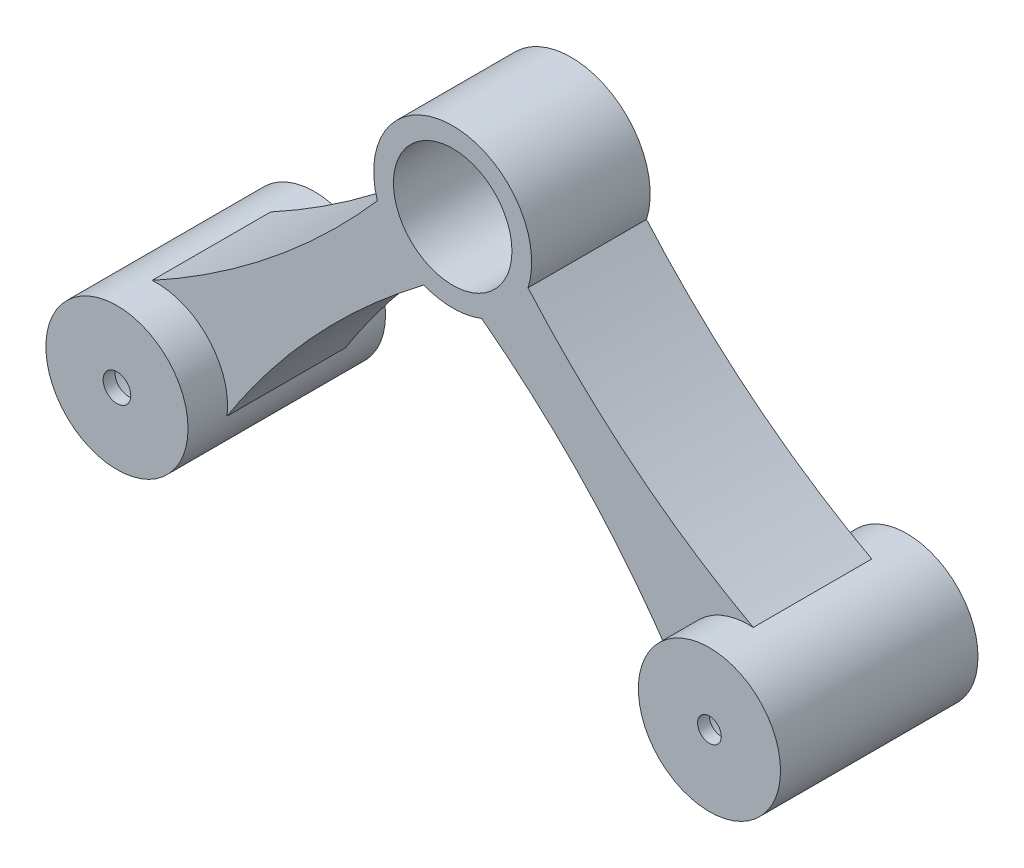
from build123d import *

# Parameters (mm, degrees)
SKETCH1_R           = 18
SKETCH1_R_2         = 12.8
BOSS_EXTRUDE1_DEPTH = 50
SKETCH2_R           = 12.8
SKETCH2_R_2         = 3.5
BOSS_EXTRUDE2_DEPTH = 3
SKETCH4_R           = 20
SKETCH4_R_2         = 15
BOSS_EXTRUDE3_DEPTH = 30
BOSS_EXTRUDE4_START = -30
BOSS_EXTRUDE4_DEPTH = 30
CUT_EXTRUDE1_START  = -20
CUT_EXTRUDE1_DEPTH  = 20
BOSS_EXTRUDE5_DEPTH = 5
SKETCH9_R           = 18
SKETCH9_R_2         = 13
BOSS_EXTRUDE6_DEPTH = 50
SKETCH10_R          = 13
SKETCH10_R_2        = 3
BOSS_EXTRUDE7_DEPTH = 3


with BuildPart() as part:
    # Sketch1 → Boss-Extrude1 (new body)
    with BuildSketch(Plane.XY):
        Circle(SKETCH1_R)
        Circle(SKETCH1_R_2, mode=Mode.SUBTRACT)
    extrude(amount=-BOSS_EXTRUDE1_DEPTH)

    # Sketch2 → Boss-Extrude2 (add)
    with BuildSketch(Plane.XY):
        Circle(SKETCH2_R)
        Circle(SKETCH2_R_2, mode=Mode.SUBTRACT)
    extrude(amount=-BOSS_EXTRUDE2_DEPTH)



with BuildPart() as body_2:
    # Sketch4 → Boss-Extrude3 (new body)
    with BuildSketch(Plane.XY.offset(-10)):
        with Locations((75, 69.93863146)):
            Circle(SKETCH4_R)
        with Locations((75, 69.93863146)):
            Circle(SKETCH4_R_2, mode=Mode.SUBTRACT)
    extrude(amount=-BOSS_EXTRUDE3_DEPTH)


with BuildPart() as part_1:
    add(part.part)

    add(body_2.part)  # Boss-Extrude4 merges body 2
    # Sketch6 → Boss-Extrude4 (add)
    with BuildSketch(Plane(origin=(0, 0, -40), x_dir=(-1, 0, 0), z_dir=(0, 0, -1)).offset(BOSS_EXTRUDE4_START)):
        with BuildLine():
            ThreePointArc((-67.66111339, 51.333773403), (-60.372925968, 56.298664259), (-55.928527591, 63.915431302))
            add(Edge.make_bspline(
                [(-55.928527591, 63.915431302), (-31.001096906, 35.423888035), (1.094833513, 17.966673025)],
                knots=[0, 0, 0, 0.881213021, 0.881213021, 0.881213021], degree=2))
            ThreePointArc((1.094833513, 17.966673025), (-13.164366629, 12.275970481), (-17.846535387, -2.345458309))
            add(Edge.make_bspline(
                [(-67.66111339, 51.333773403), (-37.500124426, 28.454534277), (-17.846535387, -2.345458309)],
                knots=[0, 0, 0, 0.881213021, 0.881213021, 0.881213021], degree=2))
        make_face()
    boss_extrude4 = extrude(amount=BOSS_EXTRUDE4_DEPTH)

    # Sketch7 → Cut-Extrude1 (cut)
    with BuildSketch(Plane(origin=(0, 0, -40), x_dir=(-1, 0, 0), z_dir=(0, 0, -1)).offset(CUT_EXTRUDE1_START)):
        with BuildLine():
            ThreePointArc((-64.440499884, 52.953433278), (-60.372925968, 56.298664259), (-57.319583414, 60.589681287))
            add(Edge.make_bspline(
                [(-57.319583414, 60.589681287), (-34.19078561, 35.583825238), (-6.336172913, 16.847934972)],
                knots=[0, 0, 0, 0.925026666, 0.925026666, 0.925026666], degree=2))
            ThreePointArc((-6.336172913, 16.847934972), (-13.164366629, 12.275970481), (-17.248883328, 5.145485781))
            add(Edge.make_bspline(
                [(-64.440499884, 52.953433278), (-37.882173467, 31.625296404), (-17.248883328, 5.145485781)],
                knots=[0, 0, 0, 0.925026666, 0.925026666, 0.925026666], degree=2))
        make_face()
    cut_extrude1 = extrude(amount=CUT_EXTRUDE1_DEPTH, mode=Mode.SUBTRACT)

    # Sketch8 → Boss-Extrude5 (add)
    with BuildSketch(Plane(origin=(0, 0, -40), x_dir=(-1, 0, 0), z_dir=(0, 0, -1))):
        with BuildLine():
            Line((-51.31256913, 41.769602741), (-45.149947709, 48.180305567))
            add(Edge.make_bspline(
                [(-18.885246909, 25.787533519), (-32.641608403, 36.15601403), (-45.149947709, 48.180305567)],
                knots=[0, 0, 0, 1, 1, 1], degree=2))
            Line((-18.885246909, 25.787533519), (-27.042084625, 17.040396006))
            add(Edge.make_bspline(
                [(-51.31256913, 41.769602741), (-38.388868676, 30.090544445), (-27.042084625, 17.040396006)],
                knots=[0, 0, 0, 1, 1, 1], degree=2))
        make_face()
    boss_extrude5 = extrude(amount=-BOSS_EXTRUDE5_DEPTH)

    # Mirror3: Boss-Extrude4 across plane
    add(boss_extrude4.mirror(Plane(origin=(75, 0, 0), x_dir=(0, 0, 1), z_dir=(1, 0, 0))))

    # Mirror4: Cut-Extrude1 across plane
    add(cut_extrude1.mirror(Plane(origin=(75, 0, 0), x_dir=(0, 0, 1), z_dir=(1, 0, 0))), mode=Mode.SUBTRACT)

    # Mirror5: Boss-Extrude5 across plane
    add(boss_extrude5.mirror(Plane(origin=(75, 0, 0), x_dir=(0, 0, 1), z_dir=(1, 0, 0))))


with BuildPart() as body_2_2:
    # Sketch9 → Boss-Extrude6 (new body)
    with BuildSketch(Plane.XY):
        with Locations((150, 0)):
            Circle(SKETCH9_R)
        with Locations((150, 0)):
            Circle(SKETCH9_R_2, mode=Mode.SUBTRACT)
    extrude(amount=-BOSS_EXTRUDE6_DEPTH)

    # Sketch10 → Boss-Extrude7 (add)
    with BuildSketch(Plane.XY):
        with Locations((150, 0)):
            Circle(SKETCH10_R)
        with Locations((150, 0)):
            Circle(SKETCH10_R_2, mode=Mode.SUBTRACT)
    extrude(amount=-BOSS_EXTRUDE7_DEPTH)


solid = Compound([part_1.part, body_2_2.part])
